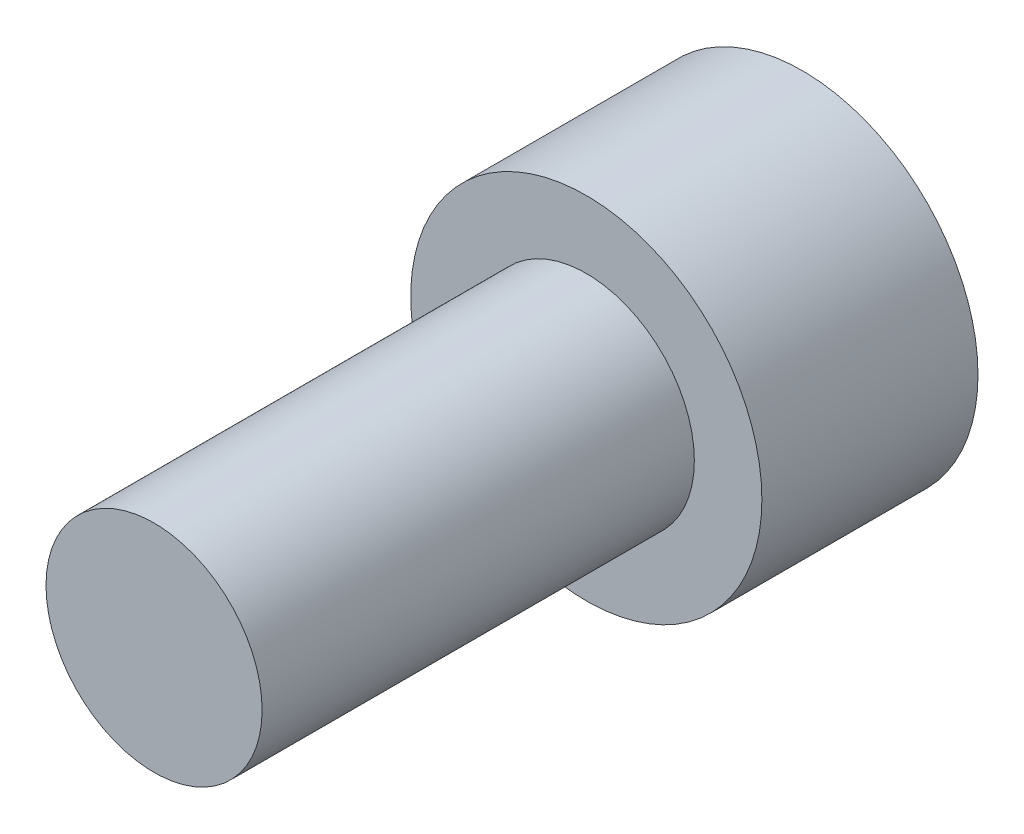
from build123d import *

# Parameters (mm, degrees)
SKETCH1_R           = 6.5
BOSS_EXTRUDE1_DEPTH = 8
SKETCH2_R           = 4
BOSS_EXTRUDE2_DEPTH = 16


with BuildPart() as part:
    # Sketch1 → Boss-Extrude1 (new body)
    with BuildSketch(Plane.XY):
        Circle(SKETCH1_R)
    extrude(amount=BOSS_EXTRUDE1_DEPTH)

    # Sketch2 → Boss-Extrude2 (add)
    with BuildSketch(Plane.XY.offset(8)):
        Circle(SKETCH2_R)
    extrude(amount=BOSS_EXTRUDE2_DEPTH)


solid = part.part
